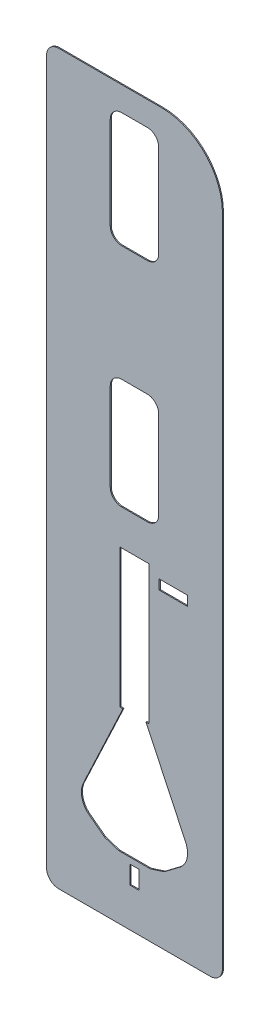
from build123d import *

# Parameters (mm, degrees)
BOSS_EXTRUDE8_DEPTH = 0.17
SKETCH1_W           = 1.5
SKETCH1_H           = 3
SKETCH1_W_2         = 4.66
SKETCH1_H_2         = 1.6
CUT_EXTRUDE1_DEPTH  = 62.727456614


with BuildPart() as part:
    # Sketch13 → Boss-Extrude8 (new body)
    with BuildSketch(Plane.XY):
        with BuildLine():
            Line((-12.5, 60), (4.5, 60))
            ThreePointArc((4.5, 60), (11.571067812, 57.071067812), (14.5, 50))
            Line((14.5, 50), (14.5, -58))
            ThreePointArc((14.5, -58), (13.914213562, -59.414213562), (12.5, -60))
            Line((12.5, -60), (-12.5, -60))
            ThreePointArc((-12.5, -60), (-13.914213562, -59.414213562), (-14.5, -58))
            Line((-14.5, -58), (-14.5, 58))
            ThreePointArc((-14.5, 58), (-13.914213562, 59.414213562), (-12.5, 60))
        make_face()
    extrude(amount=BOSS_EXTRUDE8_DEPTH)

    # Sketch1 → Cut-Extrude1 (cut, through all)
    with BuildSketch(Plane.XY.offset(0.17)):
        with Locations((0, -52.1)):
            Rectangle(SKETCH1_W, SKETCH1_H)
        with Locations((6.41, -8.27)):
            Rectangle(SKETCH1_W_2, SKETCH1_H_2)
        with BuildLine():
            Line((-2.1, 56), (2.1, 56))
            ThreePointArc((2.1, 56), (3.443502884, 55.443502884), (4, 54.1))
            Line((4, 54.1), (4, 38.9))
            ThreePointArc((4, 38.9), (3.443502884, 37.556497116), (2.1, 37))
            Line((2.1, 37), (-2.1, 37))
            ThreePointArc((-2.1, 37), (-3.443502884, 37.556497116), (-4, 38.9))
            Line((-4, 38.9), (-4, 54.1))
            ThreePointArc((-4, 54.1), (-3.443502884, 55.443502884), (-2.1, 56))
        make_face()
        with BuildLine():
            Line((-2.1, 17.931829774), (2.1, 17.931829774))
            ThreePointArc((2.1, 17.931829774), (3.443502884, 17.375332658), (4, 16.031829774))
            Line((4, 16.031829774), (4, 1.6))
            ThreePointArc((4, 1.6), (3.443502884, 0.256497116), (2.1, -0.3))
            Line((2.1, -0.3), (-2.1, -0.3))
            ThreePointArc((-2.1, -0.3), (-3.443502884, 0.256497116), (-4, 1.6))
            Line((-4, 1.6), (-4, 16.031829774))
            ThreePointArc((-4, 16.031829774), (-3.443502884, 17.375332658), (-2.1, 17.931829774))
        make_face()
        with BuildLine():
            Line((2.4, -6.15), (-2.4, -6.15))
            Line((-2.4, -6.15), (-2.4, -29))
            Line((-2.4, -29), (-1.9, -29))
            Line((-1.9, -29), (-8.375, -42.75))
            add(Edge.make_bspline(
                [(-8.375, -42.75), (-8.614001568, -43.20601542), (-8.749703343, -43.736930638), (-8.75, -44.3)],
                knots=[2, 2, 2, 2, 3, 3, 3, 3], degree=3))
            add(Edge.make_bspline(
                [(-8.75, -44.3), (-8.75059415, -45.427724457), (-8.211440188, -46.416320927), (-7.4, -46.97314145)],
                knots=[3, 3, 3, 3, 3.998304655, 3.998304655, 3.998304655, 3.998304655], degree=3))
            Line((-7.4, -46.97314145), (-4.925, -48.85))
            Line((-4.925, -48.85), (-2.6, -49.6))
            Line((-2.6, -49.6), (2.6, -49.6))
            Line((2.6, -49.6), (4.925, -48.85))
            Line((4.925, -48.85), (7.4, -46.97314145))
            add(Edge.make_bspline(
                [(7.4, -46.97314145), (8.211440188, -46.416320927), (8.75059415, -45.427724457), (8.75, -44.3)],
                knots=[3, 3, 3, 3, 3.998304655, 3.998304655, 3.998304655, 3.998304655], degree=3))
            add(Edge.make_bspline(
                [(8.75, -44.3), (8.749703343, -43.736930638), (8.614001568, -43.20601542), (8.375, -42.75)],
                knots=[2, 2, 2, 2, 3, 3, 3, 3], degree=3))
            Line((8.375, -42.75), (1.9, -29))
            Line((1.9, -29), (2.4, -29))
            Line((2.4, -29), (2.4, -6.15))
        make_face()
    extrude(amount=-CUT_EXTRUDE1_DEPTH, mode=Mode.SUBTRACT)


solid = part.part
